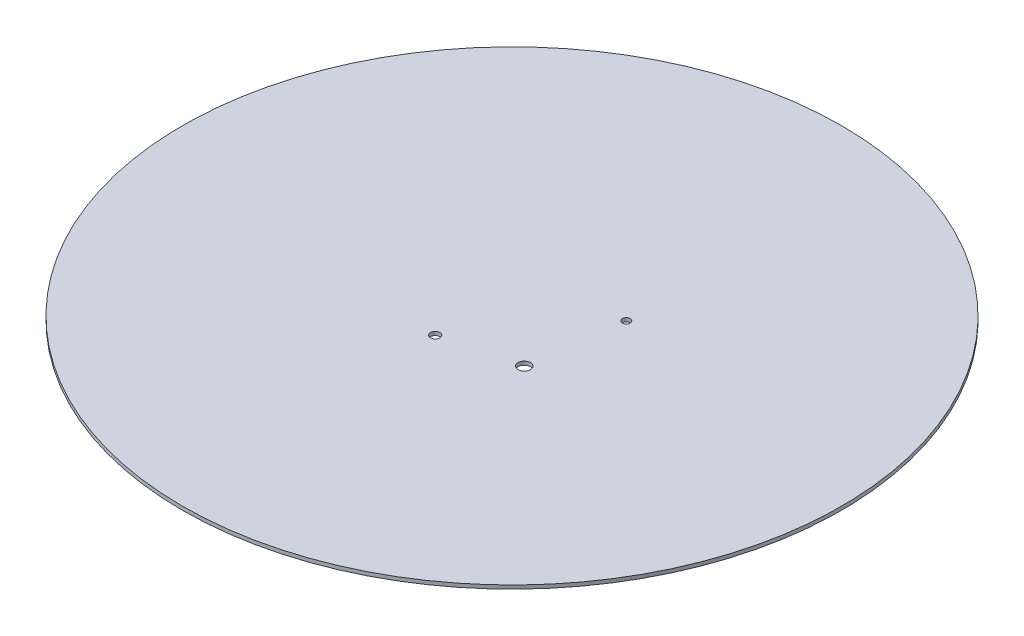
from build123d import *

# Parameters (mm, degrees)
SKETCH1_R           = 273.347390039
SKETCH1_R_2         = 3.860056217
SKETCH1_R_3         = 5.117489245
SKETCH1_R_4         = 3.217879088
BOSS_EXTRUDE1_DEPTH = 3


with BuildPart() as part:
    # Sketch1 → Boss-Extrude1 (new body)
    with BuildSketch(Plane(origin=(0, 0, 0), x_dir=(1, 0, 0), z_dir=(0, 1, 0))):
        with Locations(Location((0, 0, 0), (0, 0, 270))):
            Circle(SKETCH1_R)
        with Locations(Location((-17.98865211, -45.684133749, 0), (0, 0, 270))):
            Circle(SKETCH1_R_2, mode=Mode.SUBTRACT)
        with Locations(Location((41.136526925, -30.957876899, 0), (0, 0, 270))):
            Circle(SKETCH1_R_3, mode=Mode.SUBTRACT)
        with Locations(Location((50.91215924, 43.895297698, 0), (0, 0, 270))):
            Circle(SKETCH1_R_4, mode=Mode.SUBTRACT)
    extrude(amount=BOSS_EXTRUDE1_DEPTH)


solid = part.part
